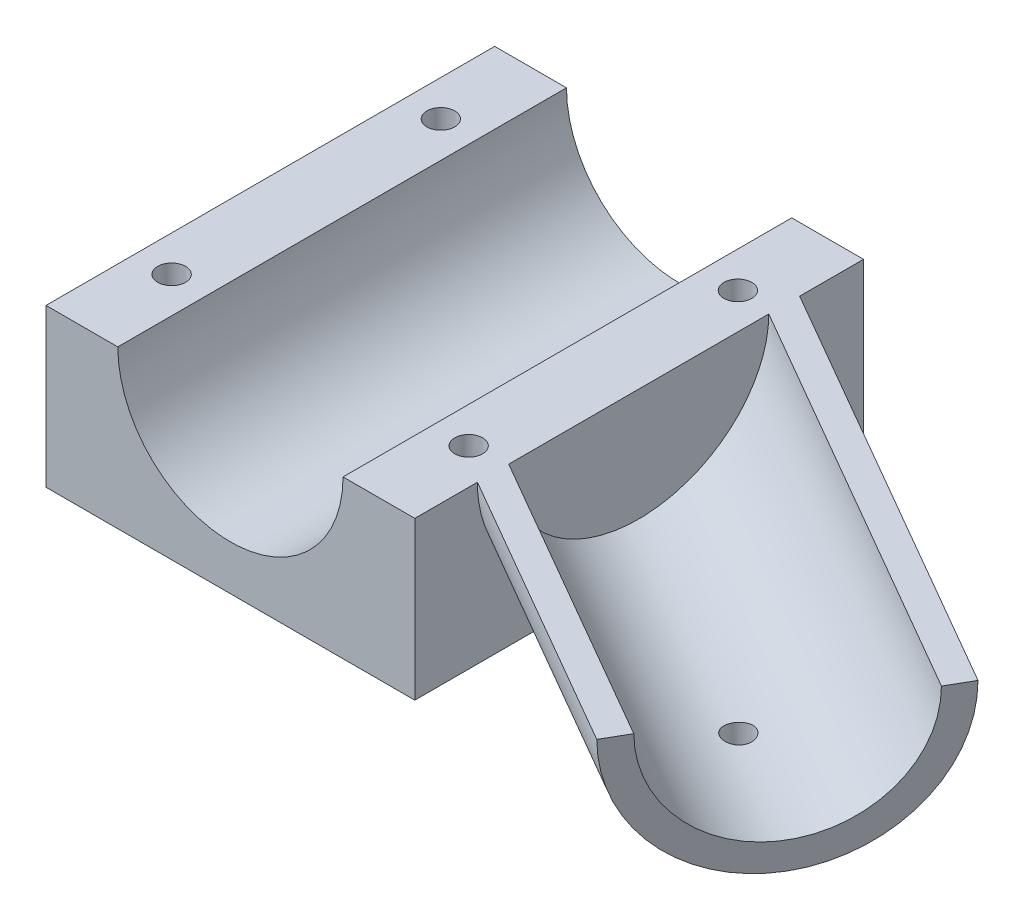
from build123d import *

# Parameters (mm, degrees)
BOSS_EXTRUDE1_DEPTH             = 25
SKETCH2_R                       = 1.55
CUT_EXTRUDE1_DEPTH              = 17.55
BOSS_EXTRUDE2_REACH             = 68.8
BOSS_EXTRUDE2_DIRECTION_2_DEPTH = 30
CUT_EXTRUDE2_REACH              = 80.634
CUT_EXTRUDE2_END_RADIUS         = 15.55
SKETCH7_R                       = 1.55


with BuildPart() as part:
    # Sketch1 → Boss-Extrude1 (new, symmetric)
    with BuildSketch(Plane.XY):
        with BuildLine():
            Line((-20.55, 17.55), (-20.55, 0))
            Line((-20.55, 0), (20.55, 0))
            Line((20.55, 0), (20.55, 17.55))
            Line((20.55, 17.55), (12.55, 17.55))
            ThreePointArc((12.55, 17.55), (0, 5), (-12.55, 17.55))
            Line((-12.55, 17.55), (-20.55, 17.55))
        make_face()
    extrude(amount=BOSS_EXTRUDE1_DEPTH, both=True)

    # Sketch2 → Cut-Extrude1 (cut)
    with BuildSketch(Plane(origin=(0, 17.55, 0), x_dir=(1, 0, 0), z_dir=(0, 1, 0))):
        with Locations(Location((-16.55, 15, 0), (0, 0, 270))):
            Circle(SKETCH2_R)
        with Locations(Location((16.55, 15, 0), (0, 0, 270))):
            Circle(SKETCH2_R)
        with Locations(Location((16.55, -15, 0), (0, 0, 270))):
            Circle(SKETCH2_R)
        with Locations(Location((-16.55, -15, 0), (0, 0, 270))):
            Circle(SKETCH2_R)
    extrude(amount=-CUT_EXTRUDE1_DEPTH, mode=Mode.SUBTRACT)

    # Boss-Extrude2: up to this plane
    boss_extrude2_end = Plane(origin=(20.55, 0, 25), z_dir=(-1, 0, 0))
    # Sketch5 → Boss-Extrude2 (add, up to the surface)
    with BuildSketch(Plane(origin=(28.704083189, 0, 16.572310156), x_dir=(0.500000000000001, 0, -0.8660254037844382), z_dir=(0.866025403784438, 0, 0.5000000000000009)), mode=Mode.PRIVATE) as boss_extrude2_sk1:
        with BuildLine():
            Line((-5.334622532, 17.55), (-2.314823147, 17.55))
            ThreePointArc((-2.314823147, 17.55), (10.235176853, 5), (22.785176853, 17.55))
            Line((22.785176853, 17.55), (25.765377468, 17.55))
            ThreePointArc((25.765377468, 17.55), (10.215377468, 2), (-5.334622532, 17.55))
        make_face()
    boss_extrude2_tool1 = split(extrude(boss_extrude2_sk1.sketch, amount=-BOSS_EXTRUDE2_REACH, mode=Mode.PRIVATE), bisect_by=boss_extrude2_end, keep=Keep.BOTH, mode=Mode.PRIVATE)
    add(boss_extrude2_tool1.solids().sort_by_distance((33.811772, 2.347709, 7.725534))[0])

    # Sketch5 → Boss-Extrude2 direction 2 (add)
    with BuildSketch(Plane(origin=(28.704083189, 0, 16.572310156), x_dir=(0.500000000000001, 0, -0.8660254037844382), z_dir=(0.866025403784438, 0, 0.5000000000000009))):
        with BuildLine():
            Line((-5.334622532, 17.55), (-2.314823147, 17.55))
            ThreePointArc((-2.314823147, 17.55), (10.235176853, 5), (22.785176853, 17.55))
            Line((22.785176853, 17.55), (25.765377468, 17.55))
            ThreePointArc((25.765377468, 17.55), (10.215377468, 2), (-5.334622532, 17.55))
        make_face()
    extrude(amount=BOSS_EXTRUDE2_DIRECTION_2_DEPTH)

    # Cut-Extrude2: up to this cylinder (the profile starts inside it)
    cut_extrude2_end = Plane(origin=(46.802153231, 17.55, 15.225533904), z_dir=(-0.8660254037844382, 0, -0.500000000000001)) * Cylinder(CUT_EXTRUDE2_END_RADIUS, 193.368, mode=Mode.PRIVATE)
    # Sketch7 → Cut-Extrude2 (cut, up to the surface)
    with BuildSketch(Plane(origin=(0, 17.55, 0), x_dir=(1, 0, 0), z_dir=(0, 1, 0)), mode=Mode.PRIVATE) as cut_extrude2_sk1:
        with Locations(Location((46.812052672, -15.20838699, 0), (0, 0, 180))):
            Circle(SKETCH7_R)
    cut_extrude2_tool1 = extrude(cut_extrude2_sk1.sketch, amount=-CUT_EXTRUDE2_REACH, mode=Mode.PRIVATE) & cut_extrude2_end
    add(cut_extrude2_tool1.solids().sort_by_distance((46.812053, 17.55, 15.208387))[0], mode=Mode.SUBTRACT)


solid = part.part
